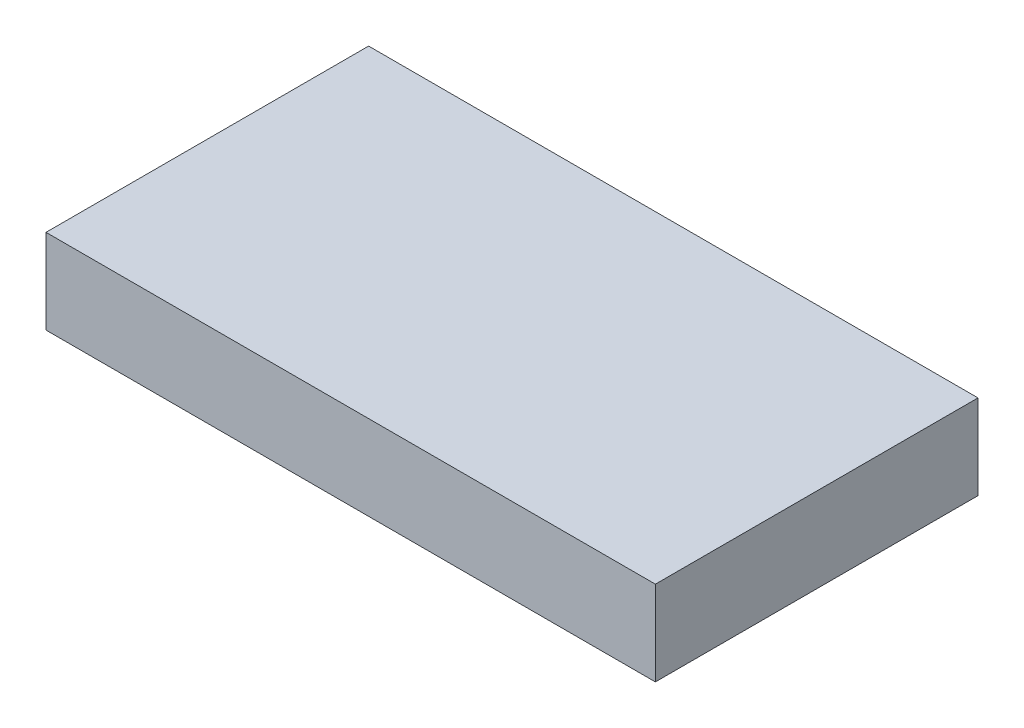
from build123d import *

# Parameters (mm, degrees)
SKETCH1_W           = 215.9
SKETCH1_H           = 114.3
BOSS_EXTRUDE1_DEPTH = 30


with BuildPart() as part:
    # Sketch1 → Boss-Extrude1 (new body)
    with BuildSketch(Plane(origin=(0, 0, 0), x_dir=(1, 0, 0), z_dir=(0, 1, 0))):
        with Locations((7.49263071, -38.726704964)):
            Rectangle(SKETCH1_W, SKETCH1_H)
    extrude(amount=BOSS_EXTRUDE1_DEPTH)


solid = part.part
